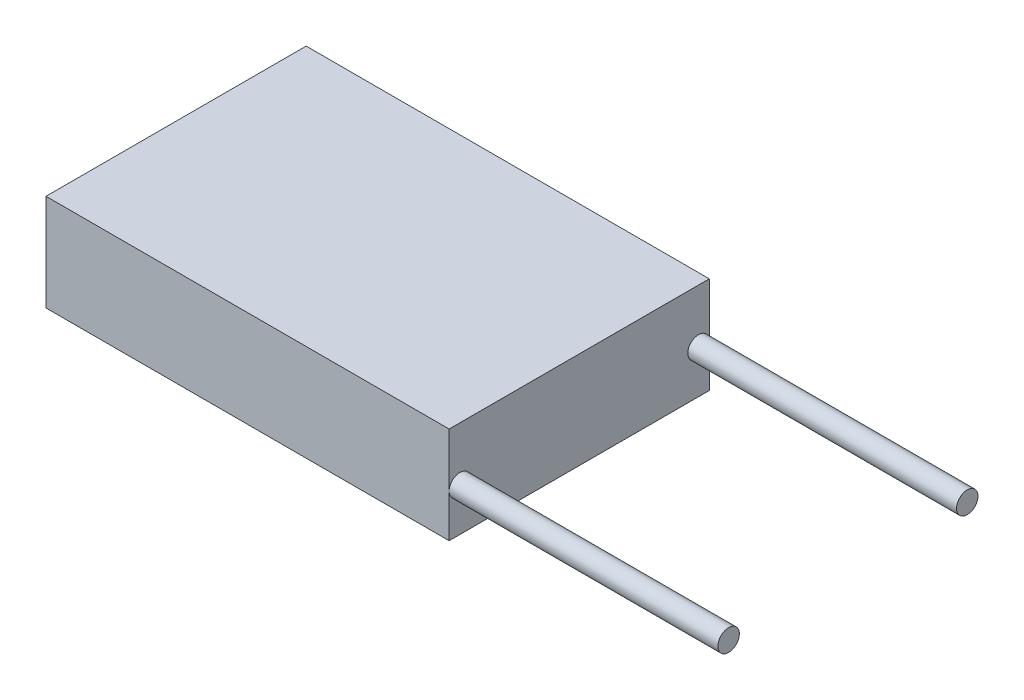
from build123d import *

# Parameters (mm, degrees)
SKETCH2_W           = 37.5
SKETCH2_H           = 24.2
BOSS_EXTRUDE1_DEPTH = 9
SKETCH3_R           = 1
BOSS_EXTRUDE2_DEPTH = 25


with BuildPart() as part:
    # Sketch2 → Boss-Extrude1 (new body)
    with BuildSketch(Plane(origin=(0, 0, 0), x_dir=(1, 0, 0), z_dir=(0, 1, 0))):
        Rectangle(SKETCH2_W, SKETCH2_H)
    extrude(amount=BOSS_EXTRUDE1_DEPTH)

    # Sketch3 → Boss-Extrude2 (add)
    with BuildSketch(Plane(origin=(18.75, 0, 0), x_dir=(0, 0, -1), z_dir=(1, 0, 0))):
        with Locations(Location((-11.1, 4, 0), (0, 0, 180))):
            Circle(SKETCH3_R)
    boss_extrude2 = extrude(amount=BOSS_EXTRUDE2_DEPTH)

    # Mirror1: Boss-Extrude2 across plane
    add(boss_extrude2.mirror(Plane.XY))


solid = part.part
